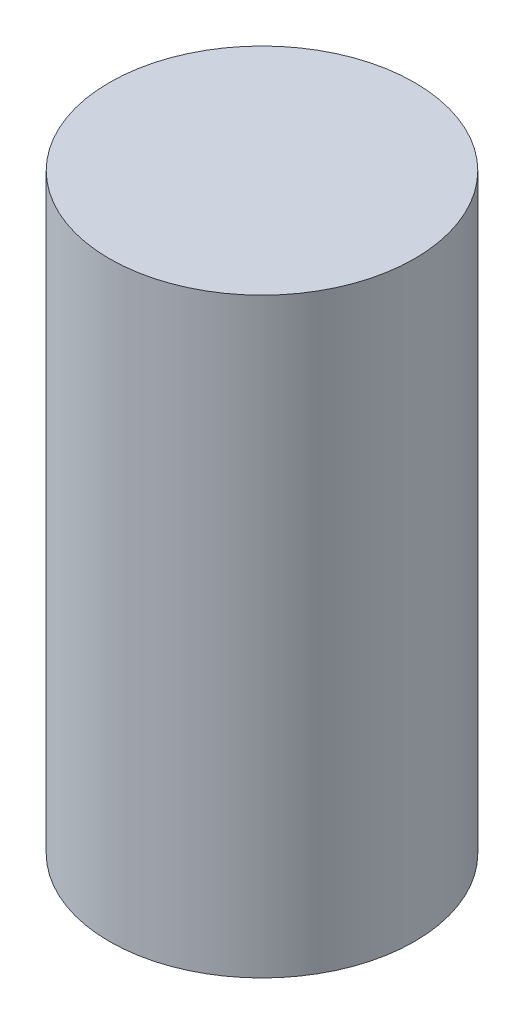
from build123d import *

# Parameters (mm, degrees)
SKETCH1_R           = 8
BOSS_EXTRUDE1_DEPTH = 31


with BuildPart() as part:
    # Sketch1 → Boss-Extrude1 (new body)
    with BuildSketch(Plane(origin=(0, 0, 0), x_dir=(1, 0, 0), z_dir=(0, 1, 0))):
        with Locations(Location((0, 0, 0), (0, 0, 270))):
            Circle(SKETCH1_R)
    extrude(amount=BOSS_EXTRUDE1_DEPTH)


solid = part.part
